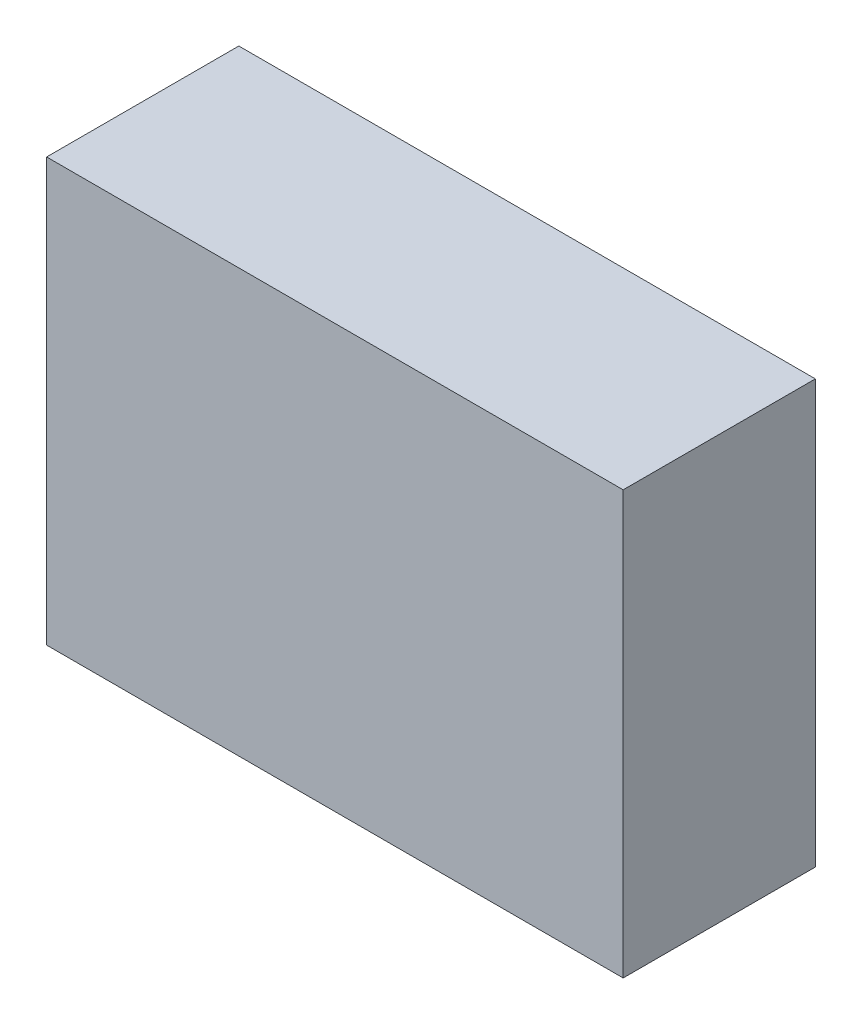
from build123d import *

# Parameters (mm, degrees)
SKETCH1_W           = 30
SKETCH1_H           = 22
BOSS_EXTRUDE1_DEPTH = 10


with BuildPart() as part:
    # Sketch1 → Boss-Extrude1 (new body)
    with BuildSketch(Plane.XY):
        Rectangle(SKETCH1_W, SKETCH1_H)
    extrude(amount=-BOSS_EXTRUDE1_DEPTH)


solid = part.part
